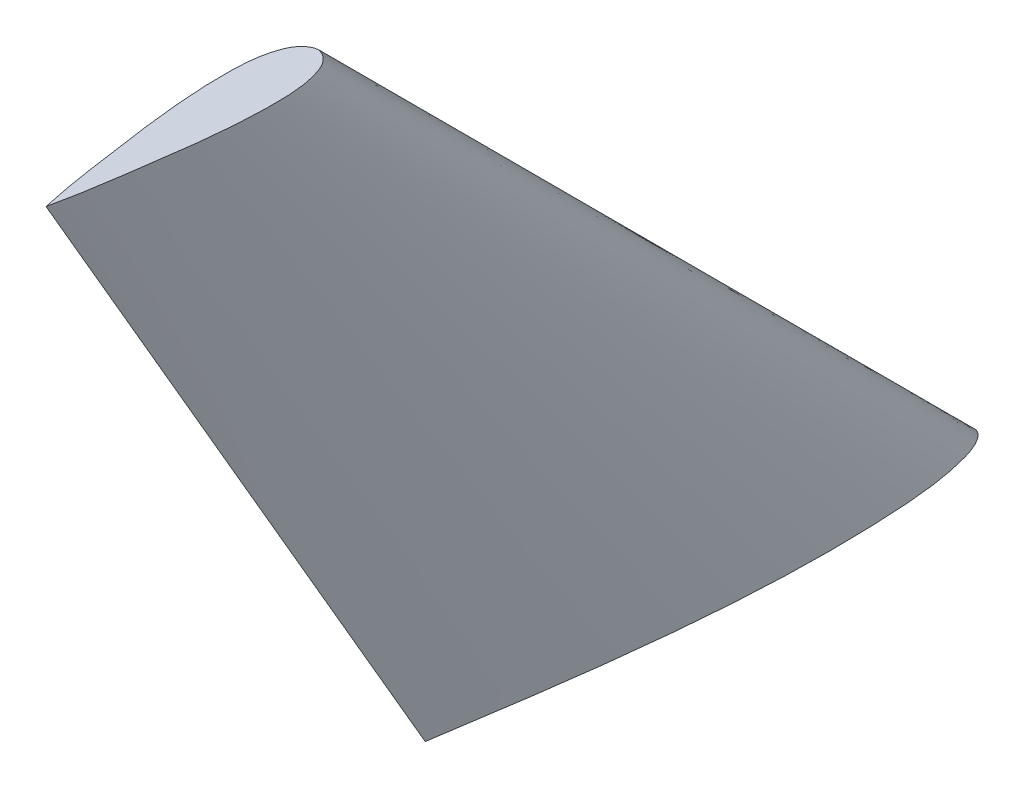
from build123d import *


with BuildPart() as part:
    # Sketch1 → Loft2 section 0
    with BuildSketch(Plane(origin=(0, 0, 0), x_dir=(1, 0, 0), z_dir=(0, 1, 0))):
        with BuildLine():
            add(Edge.make_bspline(
                [(0, 2697.12186), (42.978357959, 2725.485967523), (108.384780477, 2684.862834608), (190.004634208, 2564.375253561), (245.768884065, 2389.621314107), (322.337269458, 2034.394958927), (456.002656292, 327.1898881), (218.351845038, -1297.37661347), (0, -2697.12186)],
                knots=[0, 0, 0, 0, 0.021686289, 0.037601407, 0.078636387, 0.119260292, 0.234392663, 1, 1, 1, 1], degree=3))
            add(Edge.make_bspline(
                [(0, 2697.12186), (-42.978357959, 2725.485967523), (-108.384780477, 2684.862834608), (-190.004634208, 2564.375253561), (-245.768884065, 2389.621314107), (-322.337269458, 2034.394958927), (-456.002656292, 327.1898881), (-218.351845038, -1297.37661347), (0, -2697.12186)],
                knots=[0, 0, 0, 0, 0.021686289, 0.037601407, 0.078636387, 0.119260292, 0.234392663, 1, 1, 1, 1], degree=3))
        make_face()
    # Sketch3 → Loft2 section 1
    with BuildSketch(Plane(origin=(0, 6473.092464, 0), x_dir=(1, 0, 0), z_dir=(0, 1, 0))):
        with BuildLine():
            add(Edge.make_bspline(
                [(0, -3759.047044699), (117.183048171, -3780.235132032), (232.248911786, -4018.316297807), (275.329646145, -4692.099474576), (156.144219855, -5521.40296522), (56.538248146, -6207.331764736), (0, -6456.168904699)],
                knots=[0, 0, 0, 0, 0.115121889, 0.255727857, 0.727827845, 1, 1, 1, 1], degree=3))
            add(Edge.make_bspline(
                [(0, -3759.047044699), (-117.183048171, -3780.235132032), (-232.248911786, -4018.316297807), (-275.329646145, -4692.099474576), (-156.144219855, -5521.40296522), (-56.538248146, -6207.331764736), (0, -6456.168904699)],
                knots=[0, 0, 0, 0, 0.115121889, 0.255727857, 0.727827845, 1, 1, 1, 1], degree=3))
        make_face()
    loft()


solid = part.part
